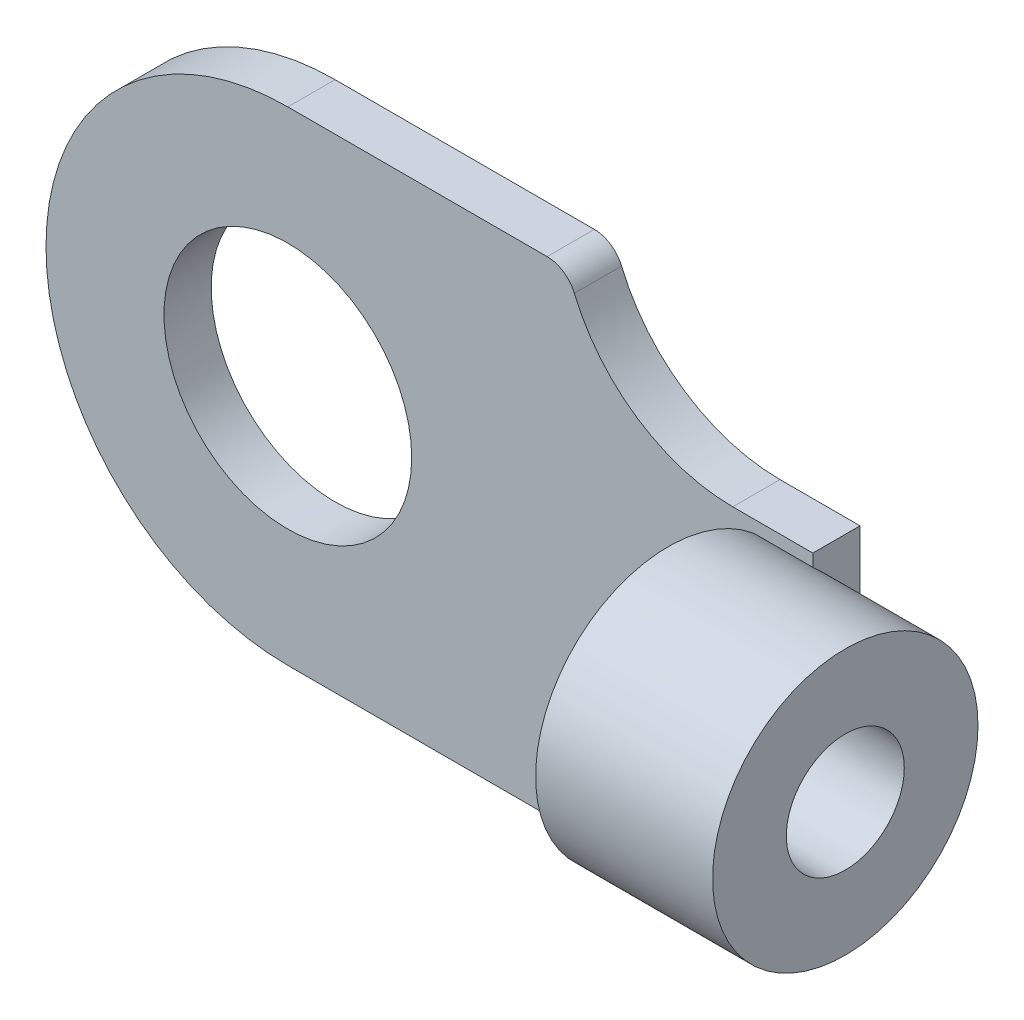
from build123d import *

# Parameters (mm, degrees)
SKETCH_1_R          = 2.1
EXTRUDE_4_DEPTH     = 0.8
SKETCH_2_R          = 2.25
SKETCH_2_R_2        = 1
EXTRUDE_5_DEPTH     = 3
FILLET_1_R          = 0.5
SKETCH_3_W          = 6.892182162
SKETCH_3_H          = 5.392211784
SKETCH_3_R          = 2.25
CUT_EXTRUDE_1_DEPTH = 2


with BuildPart() as part:
    # Эскиз1 → Вытянуть4 (new body)
    with BuildSketch(Plane.XY):
        with BuildLine():
            Line((-0.65, 4.030380872), (4.098720888, 4.030380872))
            ThreePointArc((4.098720888, 4.030380872), (5.145271439, 2.513906235), (6.892973224, 1.930380872))
            Line((6.892973224, 1.930380872), (10.25, 1.930380872))
            Line((10.25, 1.930380872), (10.25, 0.180380872))
            Line((10.25, 0.180380872), (10.25, -2.069619128))
            Line((10.25, -2.069619128), (6.892973224, -2.069619128))
            ThreePointArc((6.892973224, -2.069619128), (5.145271439, -2.653144492), (4.098720888, -4.169619128))
            Line((4.098720888, -4.169619128), (-0.65, -4.169619128))
            ThreePointArc((-0.65, -4.169619128), (-4.75, -0.069619128), (-0.65, 4.030380872))
        make_face()
        with Locations((-0.65, -0.069619128)):
            Circle(SKETCH_1_R, mode=Mode.SUBTRACT)
    extrude(amount=EXTRUDE_4_DEPTH)

    # Эскиз2 → Вытянуть5 (add)
    with BuildSketch(Plane(origin=(10.25, 0, 0), x_dir=(0, 0, -1), z_dir=(1, 0, 0))):
        with Locations((-2.25, 0)):
            Circle(SKETCH_2_R)
        with Locations((-2.25, 0)):
            Circle(SKETCH_2_R_2, mode=Mode.SUBTRACT)
    extrude(amount=-EXTRUDE_5_DEPTH)

    # Скругление1
    fillet_1_edges = [part.edges().sort_by_distance(p)[0] for p in [
        (4.098720888, -4.169619128, 0.4),
        (4.098720888, 4.030380872, 0.4),
    ]]
    fillet(fillet_1_edges, radius=FILLET_1_R)

    # Эскиз3 → Вырез-Вытянуть1 (cut)
    with BuildSketch(Plane(origin=(10.25, 0, 0), x_dir=(0, 0, -1), z_dir=(1, 0, 0))):
        with Locations((-2.090078371, -0.255202745)):
            Rectangle(SKETCH_3_W, SKETCH_3_H)
        with Locations((-2.25, 0)):
            Circle(SKETCH_3_R, mode=Mode.SUBTRACT)
    extrude(amount=-CUT_EXTRUDE_1_DEPTH, mode=Mode.SUBTRACT)


solid = part.part
